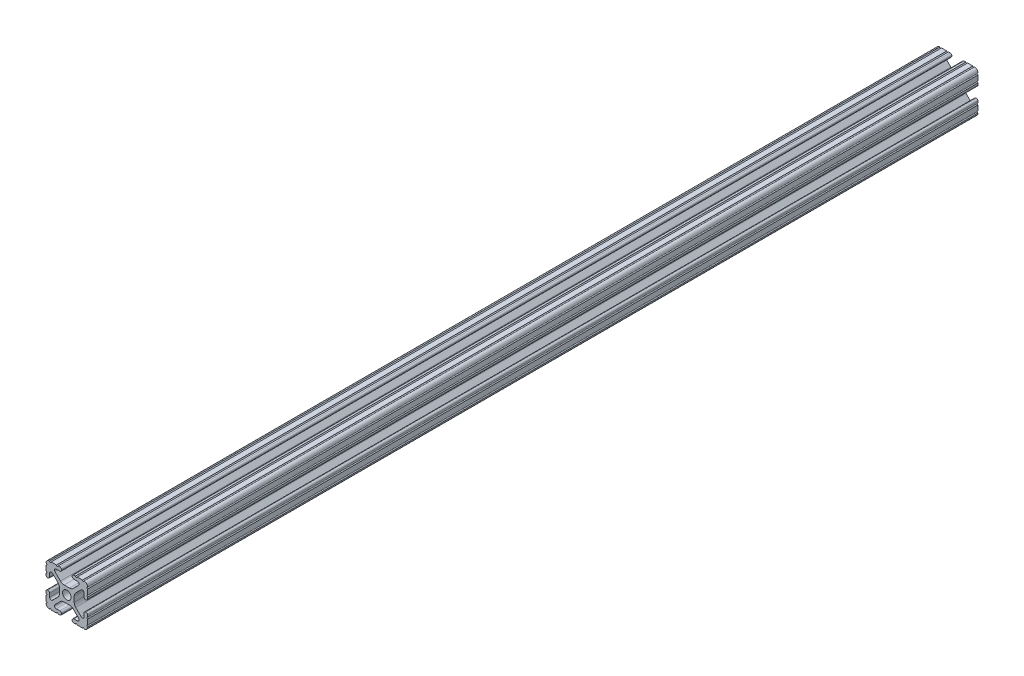
from build123d import *

# Parameters (mm, degrees)
SKETCH1_R           = 2.6035
BOSS_EXTRUDE1_DEPTH = 271.4625


with BuildPart() as part:
    # Sketch1 → Boss-Extrude1 (new, symmetric)
    with BuildSketch(Plane.XY):
        with BuildLine():
            Line((-7.179650497, -8.645192506), (-3.952270251, -5.423690499))
            ThreePointArc((-3.952270251, -5.423690499), (-2.922936451, -4.736929036), (-1.709253557, -4.4958))
            Line((-1.709253557, -4.4958), (1.709253557, -4.4958))
            ThreePointArc((1.709253557, -4.4958), (2.922936451, -4.736929036), (3.952270251, -5.423690499))
            Line((3.952270251, -5.423690499), (7.179650497, -8.645192506))
            ThreePointArc((7.179650497, -8.645192506), (7.41473083, -9.822813117), (6.416408329, -10.4902))
            Line((6.416408329, -10.4902), (4.287512407, -10.4902))
            ThreePointArc((4.287512407, -10.4902), (3.54574862, -10.79744862), (3.2385, -11.539212407))
            Line((3.2385, -11.539212407), (3.2385, -11.650987593))
            ThreePointArc((3.2385, -11.650987593), (3.54574862, -12.39275138), (4.287512407, -12.7))
            Line((4.287512407, -12.7), (5.317126718, -12.7))
            ThreePointArc((5.317126718, -12.7), (5.825126718, -12.192), (6.333126718, -12.7))
            Line((6.333126718, -12.7), (9.550443118, -12.7))
            ThreePointArc((9.550443118, -12.7), (10.058366869, -12.192000006), (10.566443095, -12.699847501))
            ThreePointArc((10.566443095, -12.699847501), (12.082537762, -12.08250727), (12.699846982, -10.566399977))
            ThreePointArc((12.699846982, -10.566399977), (12.192000006, -10.058323491), (12.7, -9.5504))
            Line((12.7, -9.5504), (12.7, -6.3330836))
            ThreePointArc((12.7, -6.3330836), (12.192, -5.8250836), (12.7, -5.3170836))
            Line((12.7, -5.3170836), (12.7, -4.287469289))
            ThreePointArc((12.7, -4.287469289), (12.39275138, -3.545705502), (11.650987593, -3.238456882))
            Line((11.650987593, -3.238456882), (11.539212407, -3.238456882))
            ThreePointArc((11.539212407, -3.238456882), (10.79744862, -3.545705502), (10.4902, -4.287469289))
            Line((10.4902, -4.287469289), (10.4902, -6.402089023))
            ThreePointArc((10.4902, -6.402089023), (9.856505071, -7.351067942), (8.737131347, -7.129408934))
            Line((8.737131347, -7.129408934), (5.441005833, -3.840816462))
            ThreePointArc((5.441005833, -3.840816462), (4.750877967, -2.809883091), (4.5085, -1.593185507))
            Line((4.5085, -1.593185507), (4.5085, 1.593185507))
            ThreePointArc((4.5085, 1.593185507), (4.750877967, 2.809883091), (5.441005833, 3.840816462))
            Line((5.441005833, 3.840816462), (8.737131347, 7.129408934))
            ThreePointArc((8.737131347, 7.129408934), (9.856505071, 7.351067942), (10.4902, 6.402089023))
            Line((10.4902, 6.402089023), (10.4902, 4.287469289))
            ThreePointArc((10.4902, 4.287469289), (10.79744862, 3.545705502), (11.539212407, 3.238456882))
            Line((11.539212407, 3.238456882), (11.650987593, 3.238456882))
            ThreePointArc((11.650987593, 3.238456882), (12.39275138, 3.545705502), (12.7, 4.287469289))
            Line((12.7, 4.287469289), (12.7, 5.3170836))
            ThreePointArc((12.7, 5.3170836), (12.192, 5.8250836), (12.7, 6.3330836))
            Line((12.7, 6.3330836), (12.7, 9.5504))
            ThreePointArc((12.7, 9.5504), (12.192000006, 10.058323491), (12.699846982, 10.566399977))
            ThreePointArc((12.699846982, 10.566399977), (12.082537762, 12.08250727), (10.566443095, 12.699847501))
            ThreePointArc((10.566443095, 12.699847501), (10.058366869, 12.192000006), (9.550443118, 12.7))
            Line((9.550443118, 12.7), (6.333126718, 12.7))
            ThreePointArc((6.333126718, 12.7), (5.825126718, 12.192), (5.317126718, 12.7))
            Line((5.317126718, 12.7), (4.287512407, 12.7))
            ThreePointArc((4.287512407, 12.7), (3.54574862, 12.39275138), (3.2385, 11.650987593))
            Line((3.2385, 11.650987593), (3.2385, 11.539212407))
            ThreePointArc((3.2385, 11.539212407), (3.54574862, 10.79744862), (4.287512407, 10.4902))
            Line((4.287512407, 10.4902), (6.476788598, 10.4902))
            ThreePointArc((6.476788598, 10.4902), (7.432222385, 9.85140422), (7.207036008, 8.724370562))
            Line((7.207036008, 8.724370562), (3.898272566, 5.423169045))
            ThreePointArc((3.898272566, 5.423169045), (2.869120213, 4.736787962), (1.655778399, 4.4958))
            Line((1.655778399, 4.4958), (-1.655778399, 4.4958))
            ThreePointArc((-1.655778399, 4.4958), (-2.869120213, 4.736787962), (-3.898272566, 5.423169045))
            Line((-3.898272566, 5.423169045), (-7.207036008, 8.724370562))
            ThreePointArc((-7.207036008, 8.724370562), (-7.432222385, 9.85140422), (-6.476788598, 10.4902))
            Line((-6.476788598, 10.4902), (-4.287512407, 10.4902))
            ThreePointArc((-4.287512407, 10.4902), (-3.54574862, 10.79744862), (-3.2385, 11.539212407))
            Line((-3.2385, 11.539212407), (-3.2385, 11.650987593))
            ThreePointArc((-3.2385, 11.650987593), (-3.54574862, 12.39275138), (-4.287512407, 12.7))
            Line((-4.287512407, 12.7), (-5.317126718, 12.7))
            ThreePointArc((-5.317126718, 12.7), (-5.825126718, 12.192), (-6.333126718, 12.7))
            Line((-6.333126718, 12.7), (-9.550443118, 12.7))
            ThreePointArc((-9.550443118, 12.7), (-10.058366869, 12.192000006), (-10.566443095, 12.699847501))
            ThreePointArc((-10.566443095, 12.699847501), (-12.082537762, 12.08250727), (-12.699846982, 10.566399977))
            ThreePointArc((-12.699846982, 10.566399977), (-12.192000006, 10.058323491), (-12.7, 9.5504))
            Line((-12.7, 9.5504), (-12.7, 6.3330836))
            ThreePointArc((-12.7, 6.3330836), (-12.192, 5.8250836), (-12.7, 5.3170836))
            Line((-12.7, 5.3170836), (-12.7, 4.287469289))
            ThreePointArc((-12.7, 4.287469289), (-12.39275138, 3.545705502), (-11.650987593, 3.238456882))
            Line((-11.650987593, 3.238456882), (-11.539212407, 3.238456882))
            ThreePointArc((-11.539212407, 3.238456882), (-10.79744862, 3.545705502), (-10.4902, 4.287469289))
            Line((-10.4902, 4.287469289), (-10.4902, 6.402089023))
            ThreePointArc((-10.4902, 6.402089023), (-9.856505071, 7.351067942), (-8.737131347, 7.129408934))
            Line((-8.737131347, 7.129408934), (-5.441005833, 3.840816462))
            ThreePointArc((-5.441005833, 3.840816462), (-4.750877967, 2.809883091), (-4.5085, 1.593185507))
            Line((-4.5085, 1.593185507), (-4.5085, -1.593185507))
            ThreePointArc((-4.5085, -1.593185507), (-4.750877967, -2.809883091), (-5.441005833, -3.840816462))
            Line((-5.441005833, -3.840816462), (-8.737131347, -7.129408934))
            ThreePointArc((-8.737131347, -7.129408934), (-9.856505071, -7.351067942), (-10.4902, -6.402089023))
            Line((-10.4902, -6.402089023), (-10.4902, -4.287469289))
            ThreePointArc((-10.4902, -4.287469289), (-10.79744862, -3.545705502), (-11.539212407, -3.238456882))
            Line((-11.539212407, -3.238456882), (-11.650987593, -3.238456882))
            ThreePointArc((-11.650987593, -3.238456882), (-12.39275138, -3.545705502), (-12.7, -4.287469289))
            Line((-12.7, -4.287469289), (-12.7, -5.3170836))
            ThreePointArc((-12.7, -5.3170836), (-12.192, -5.8250836), (-12.7, -6.3330836))
            Line((-12.7, -6.3330836), (-12.7, -9.5504))
            ThreePointArc((-12.7, -9.5504), (-12.192000006, -10.058323491), (-12.699846982, -10.566399977))
            ThreePointArc((-12.699846982, -10.566399977), (-12.082537762, -12.08250727), (-10.566443095, -12.699847501))
            ThreePointArc((-10.566443095, -12.699847501), (-10.058366869, -12.192000006), (-9.550443118, -12.7))
            Line((-9.550443118, -12.7), (-6.333126718, -12.7))
            ThreePointArc((-6.333126718, -12.7), (-5.825126718, -12.192), (-5.317126718, -12.7))
            Line((-5.317126718, -12.7), (-4.287512407, -12.7))
            ThreePointArc((-4.287512407, -12.7), (-3.54574862, -12.39275138), (-3.2385, -11.650987593))
            Line((-3.2385, -11.650987593), (-3.2385, -11.539212407))
            ThreePointArc((-3.2385, -11.539212407), (-3.54574862, -10.79744862), (-4.287512407, -10.4902))
            Line((-4.287512407, -10.4902), (-6.416408329, -10.4902))
            ThreePointArc((-6.416408329, -10.4902), (-7.41473083, -9.822813117), (-7.179650497, -8.645192506))
        make_face()
        Circle(SKETCH1_R, mode=Mode.SUBTRACT)
    extrude(amount=BOSS_EXTRUDE1_DEPTH, both=True)


solid = part.part
